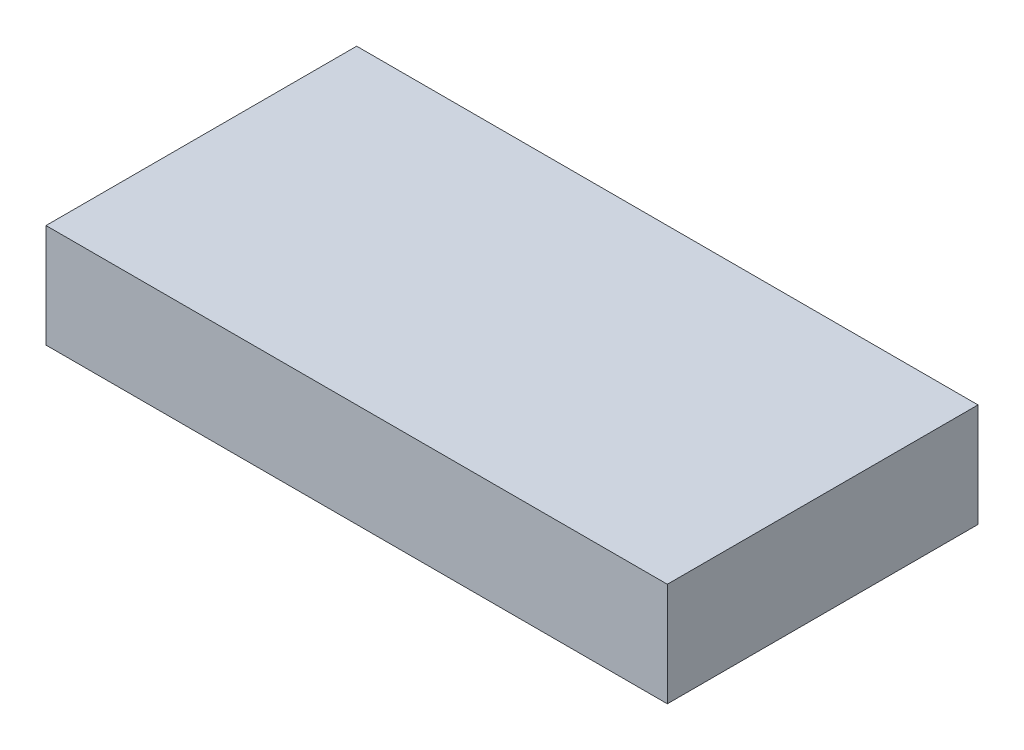
from build123d import *

# Parameters (mm, degrees)
SKETCH1_W           = 304.8
SKETCH1_H           = 152.4
BOSS_EXTRUDE1_DEPTH = 50.8


with BuildPart() as part:
    # Sketch1 → Boss-Extrude1 (new body)
    with BuildSketch(Plane(origin=(0, 0, 0), x_dir=(1, 0, 0), z_dir=(0, 1, 0))):
        Rectangle(SKETCH1_W, SKETCH1_H)
    extrude(amount=BOSS_EXTRUDE1_DEPTH)


solid = part.part
